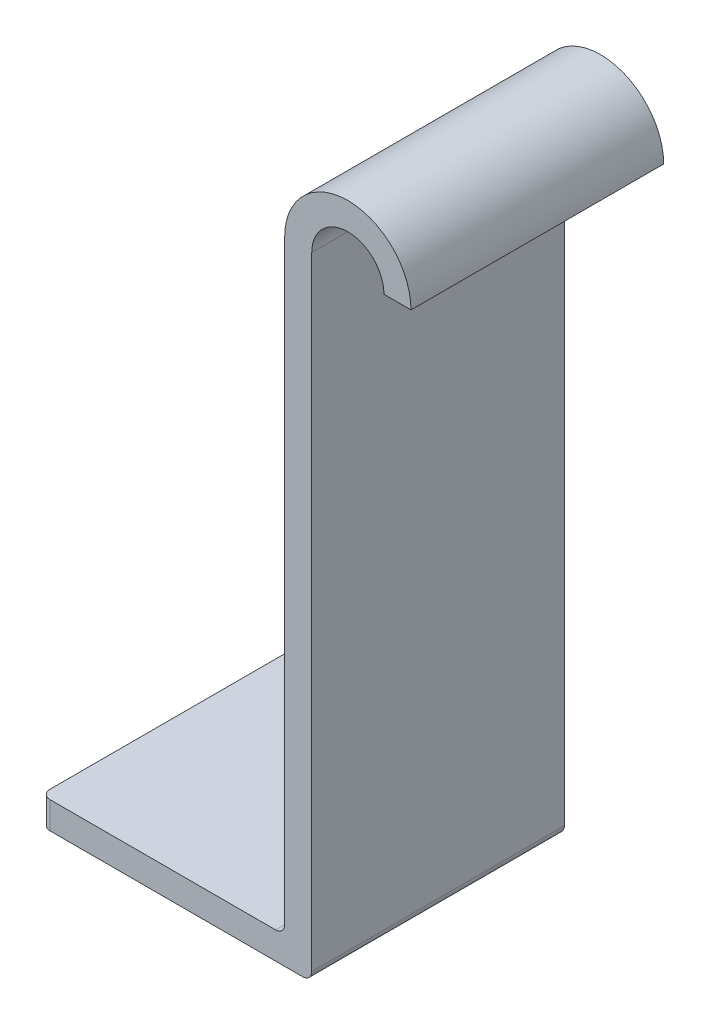
from build123d import *

# Parameters (mm, degrees)
BOSS_EXTRUDE1_DEPTH = 28
FILLET1_R           = 1


with BuildPart() as part:
    # Sketch1 → Boss-Extrude1 (new body)
    with BuildSketch(Plane.XY):
        with BuildLine():
            Line((0, 0), (0, -70))
            Line((0, -70), (-30, -70))
            Line((-30, -70), (-30, -67))
            Line((-30, -67), (-3, -67))
            Line((-3, -67), (-3, 0))
            ThreePointArc((-3, 0), (4, 7), (11, 0))
            Line((11, 0), (8, 0))
            ThreePointArc((8, 0), (4, 4), (0, 0))
        make_face()
    extrude(amount=BOSS_EXTRUDE1_DEPTH)

    # Fillet1
    fillet1_edges = [part.edges().sort_by_distance(p)[0] for p in [
        (0, -70, 14),
        (-3, -67, 14),
        (-30, -68.5, 28),
        (-30, -68.5, 0),
    ]]
    fillet(fillet1_edges, radius=FILLET1_R)


solid = part.part
